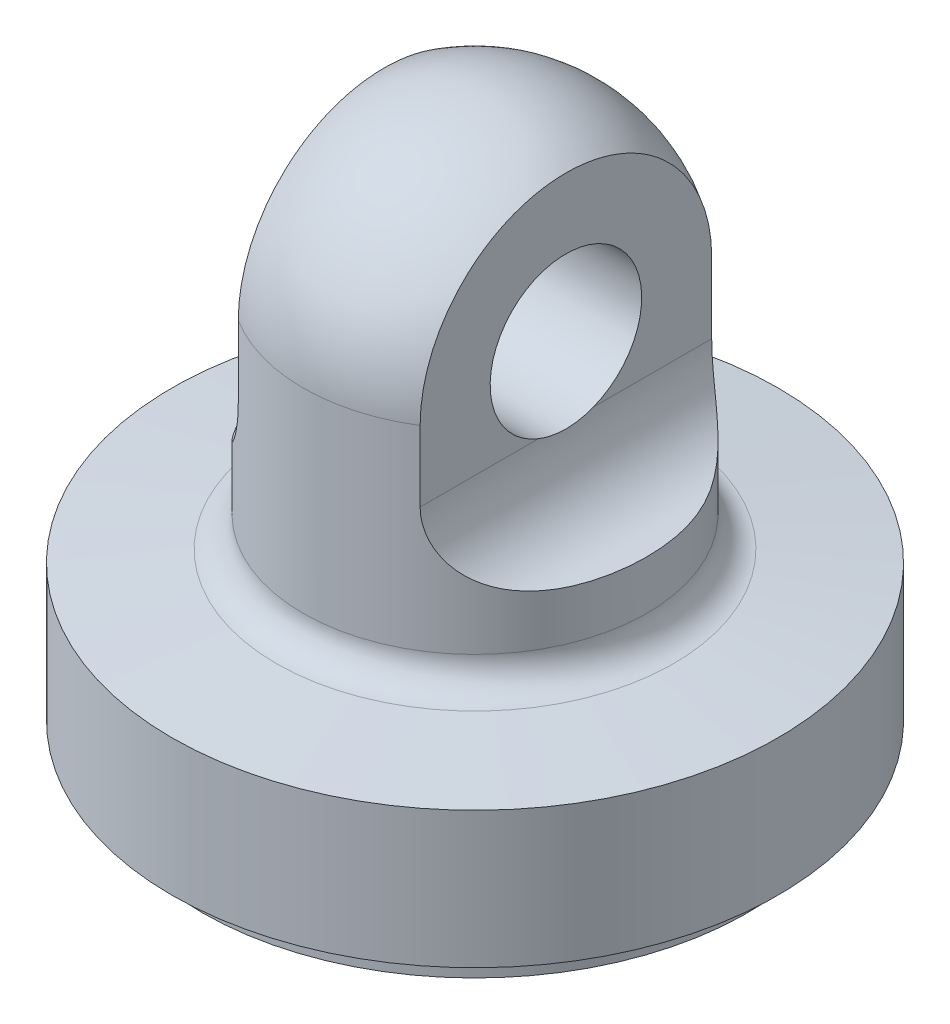
from build123d import *

# Parameters (mm, degrees)
CUT_EXTRUDE1_DEPTH      = 30.071628781
CUT_EXTRUDE1_DEPTH_BACK = 30.071628781
CUT_EXTRUDE2_DEPTH      = 31.926520981
CUT_EXTRUDE2_DEPTH_BACK = 31.926520981
SKETCH4_R               = 3.175


with BuildPart() as part:
    # Sketch1 → Revolve1 (revolve)
    with BuildSketch(Plane.XY, mode=Mode.PRIVATE) as revolve1_sk:
        with BuildLine():
            Line((-12.7, 0), (-12.7, 5.715))
            Line((-12.7, 5.715), (-8.325216792, 6.220171271))
            ThreePointArc((-8.325216792, 6.220171271), (-7.522765602, 6.636837464), (-7.2009, 7.481787854))
            Line((-7.2009, 7.481787854), (-7.2009, 15.6591))
            ThreePointArc((-7.2009, 15.6591), (-5.091805221, 20.750905221), (0, 22.86))
            Line((0, 22.86), (0, 6.35))
            Line((0, 6.35), (0, 0))
            Line((0, 0), (0, -1.27))
            Line((0, -1.27), (-11.43, -1.27))
            Line((-11.43, -1.27), (-11.43, 0))
            Line((-11.43, 0), (-12.7, 0))
        make_face()
    revolve(revolve1_sk.sketch.rotate(Axis((0, 6.35, 0), (0, -1, 0)), 270), axis=Axis((0, 6.35, 0), (0, -1, 0)))

    # Sketch3 → Cut-Extrude1 (cut, two sides: drawn at the far end of the back side and taken through both)
    with BuildSketch(Plane.XY.offset(-CUT_EXTRUDE1_DEPTH_BACK)):
        with BuildLine():
            Line((-3.81, 22.86), (-3.81, 12.7))
            ThreePointArc((-3.81, 12.7), (-6.985, 9.525), (-10.16, 12.7))
            Line((-10.16, 12.7), (-10.16, 22.86))
            Line((-10.16, 22.86), (-3.81, 22.86))
        make_face()
        with BuildLine():
            Line((10.16, 22.86), (10.16, 12.7))
            ThreePointArc((10.16, 12.7), (6.985, 9.525), (3.81, 12.7))
            Line((3.81, 12.7), (3.81, 22.86))
            Line((3.81, 22.86), (10.16, 22.86))
        make_face()
    extrude(amount=CUT_EXTRUDE1_DEPTH + CUT_EXTRUDE1_DEPTH_BACK, mode=Mode.SUBTRACT)

    # Sketch4 → Cut-Extrude2 (cut, two sides: drawn at the far end of the back side and taken through both)
    with BuildSketch(Plane.ZY.offset(3.81).offset(-CUT_EXTRUDE2_DEPTH_BACK)):
        with Locations(Location((0, 15.6591, 0), (0, 0, 248.748756024))):
            Circle(SKETCH4_R)
    extrude(amount=CUT_EXTRUDE2_DEPTH + CUT_EXTRUDE2_DEPTH_BACK, mode=Mode.SUBTRACT)


solid = part.part
